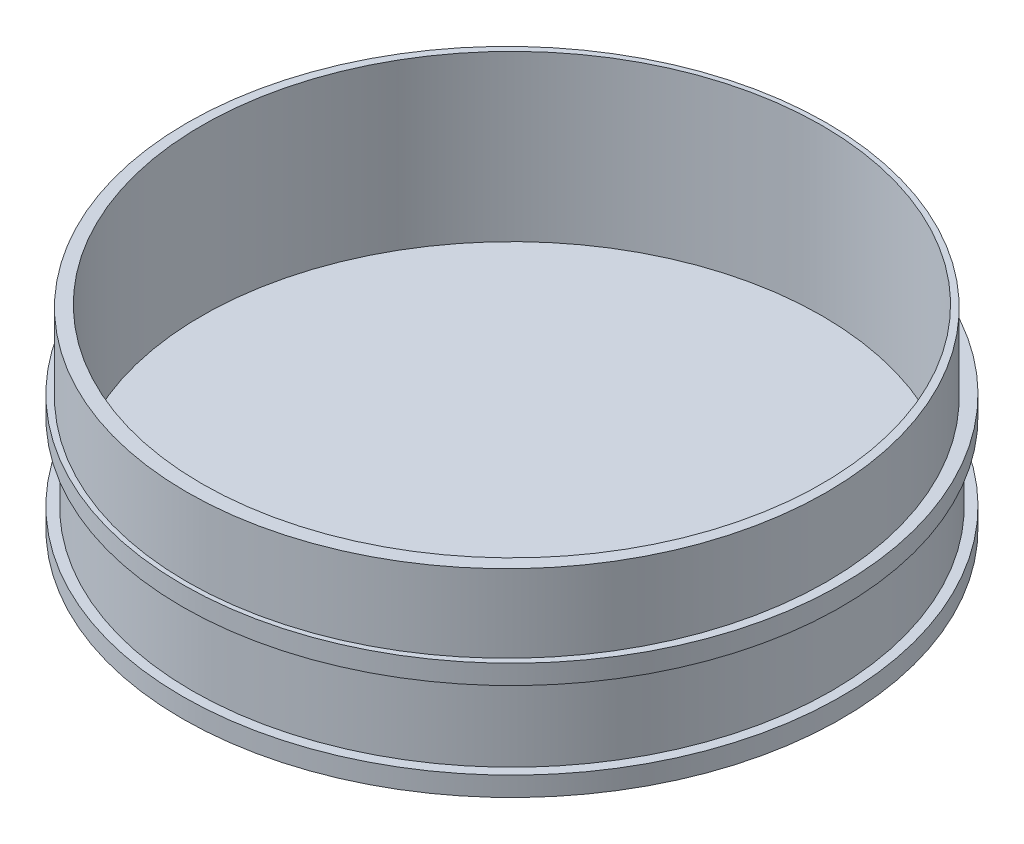
from build123d import *

# Parameters (mm, degrees)
SKETCH_1_R          = 17
EXTRUDE_1_DEPTH     = 1
SKETCH_2_R          = 16.5
EXTRUDE_2_DEPTH     = 4
SKETCH_3_R          = 17
EXTRUDE_3_DEPTH     = 1
SKETCH_4_R          = 16.5
EXTRUDE_4_DEPTH     = 4
SKETCH_5_R          = 16
CUT_EXTRUDE_1_DEPTH = 8.5


with BuildPart() as part:
    # 草图1 → 凸台-拉伸1 (new body)
    with BuildSketch(Plane(origin=(0, 0, 0), x_dir=(1, 0, 0), z_dir=(0, 1, 0))):
        with Locations(Location((0, 0, 0), (0, 0, 270))):
            Circle(SKETCH_1_R)
    extrude(amount=EXTRUDE_1_DEPTH)

    # 草图2 → 凸台-拉伸2 (add)
    with BuildSketch(Plane(origin=(0, 1, 0), x_dir=(1, 0, 0), z_dir=(0, 1, 0))):
        with Locations(Location((0, 0, 0), (0, 0, 270))):
            Circle(SKETCH_2_R)
    extrude(amount=EXTRUDE_2_DEPTH)

    # 草图3 → 凸台-拉伸3 (add)
    with BuildSketch(Plane(origin=(0, 5, 0), x_dir=(1, 0, 0), z_dir=(0, 1, 0))):
        with Locations(Location((0, 0, 0), (0, 0, 270))):
            Circle(SKETCH_3_R)
    extrude(amount=EXTRUDE_3_DEPTH)

    # 草图4 → 凸台-拉伸4 (add)
    with BuildSketch(Plane(origin=(0, 6, 0), x_dir=(1, 0, 0), z_dir=(0, 1, 0))):
        with Locations(Location((0, -0.263172859, 0), (0, 0, 270))):
            Circle(SKETCH_4_R)
    extrude(amount=EXTRUDE_4_DEPTH)

    # 草图5 → 切除-拉伸1 (cut)
    with BuildSketch(Plane(origin=(0, 10, 0), x_dir=(1, 0, 0), z_dir=(0, 1, 0))):
        with Locations(Location((0, 0, 0), (0, 0, 270))):
            Circle(SKETCH_5_R)
    extrude(amount=-CUT_EXTRUDE_1_DEPTH, mode=Mode.SUBTRACT)


solid = part.part
